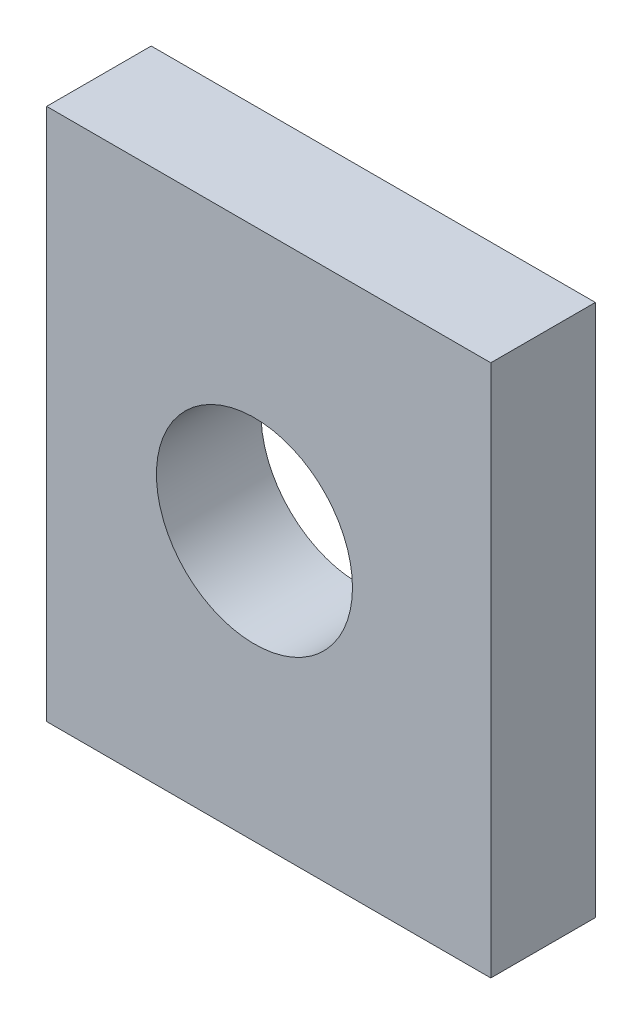
from build123d import *

# Parameters (mm, degrees)
SKETCH1_W           = 10.195
SKETCH1_H           = 12.23
BOSS_EXTRUDE1_DEPTH = 2.4
SKETCH4_R           = 2.25
CUT_EXTRUDE2_DEPTH  = 5


with BuildPart() as part:
    # Sketch1 → Boss-Extrude1 (new body)
    with BuildSketch(Plane.XY):
        with Locations((-13.4225, 32.127080843)):
            Rectangle(SKETCH1_W, SKETCH1_H)
    extrude(amount=-BOSS_EXTRUDE1_DEPTH)

    # Sketch4 → Cut-Extrude2 (cut)
    with BuildSketch(Plane.XY):
        with Locations((-13.75, 32.187080843)):
            Circle(SKETCH4_R)
    extrude(amount=-CUT_EXTRUDE2_DEPTH, mode=Mode.SUBTRACT)


solid = part.part
